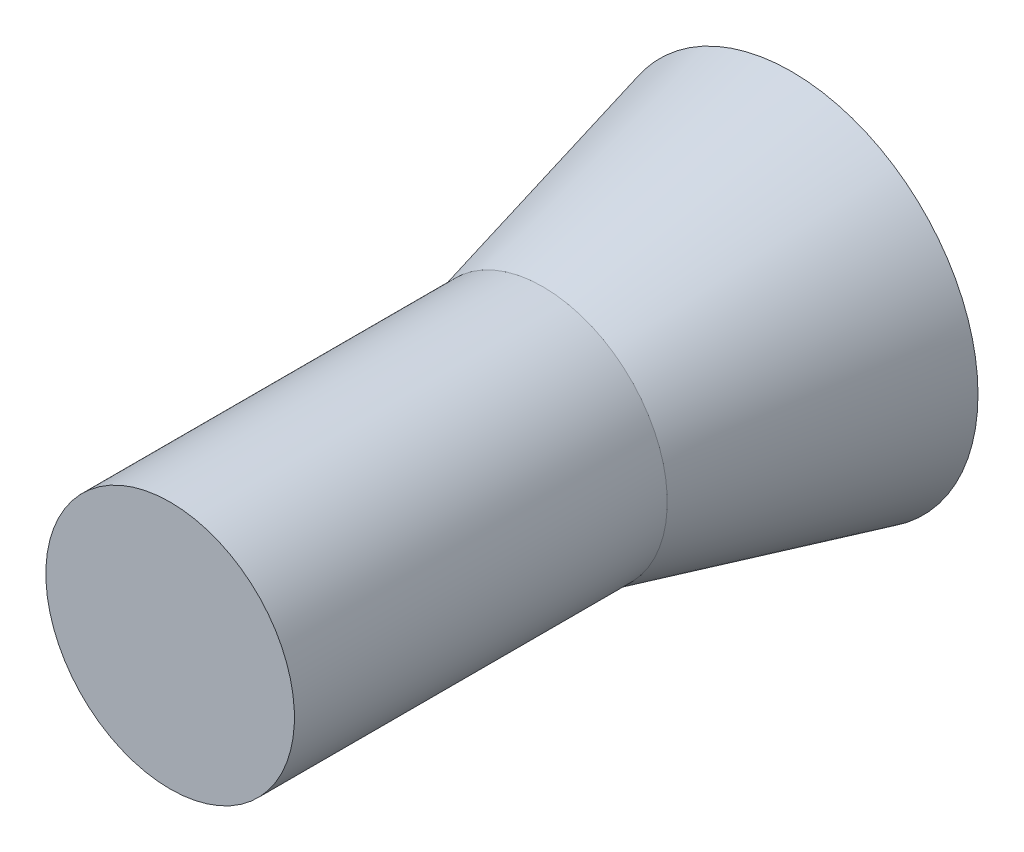
from build123d import *


with BuildPart() as part:
    # Sketch1 → Revolve1 (revolve)
    with BuildSketch(Plane(origin=(0, 0, 0), x_dir=(0, 0, -1), z_dir=(1, 0, 0))):
        Polygon((0, 0), (-50, 0), (-50, 10), (-20, 10), (0, 15), align=None)
    revolve(axis=Axis((0, 0, 0), (0, 0, 1)))


solid = part.part
